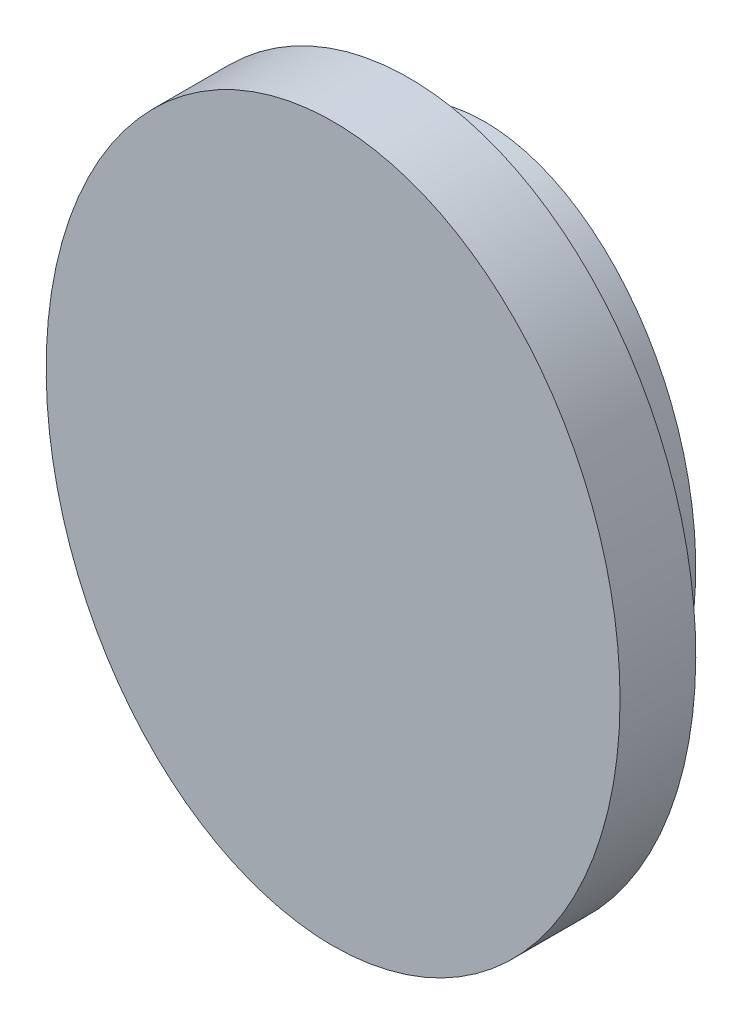
from build123d import *

# Parameters (mm, degrees)
BOSS_EXTRUDE1_DEPTH = 2.54
SKETCH3_RX          = 11.975002362
SKETCH3_RY          = 9.62530498
BOSS_EXTRUDE2_DEPTH = 2.54


with BuildPart() as part:
    # Sketch2 → Boss-Extrude1 (new body)
    with BuildSketch(Plane.XY):
        with BuildLine():
            add(Edge.make_bspline(
                [(1.27, 19.495012235), (0.720238368, 19.495012235), (0.185844427, 19.408896346), (-0.594767976, 19.162165307), (-0.850648642, 19.060010591), (-1.3406975, 18.824771934), (-1.57692884, 18.691089586), (-2.033244262, 18.394227435), (-2.254387801, 18.229997746), (-2.672354965, 17.881330388), (-2.870146059, 17.696467096), (-3.245718092, 17.307915457), (-3.423486564, 17.104215382), (-3.760412379, 16.679306346), (-3.920187654, 16.457107827), (-4.368044809, 15.772573183), (-4.623081735, 15.296400873), (-5.058948628, 14.310278998), (-5.239624245, 13.800259175), (-5.675397109, 12.221835404), (-5.815116994, 11.150473237), (-5.815398697, 9.517977005), (-5.779430411, 8.974598965), (-5.637433758, 7.906555412), (-5.53145557, 7.379220198), (-5.31698931, 6.598826265), (-5.236201641, 6.340472484), (-5.054795439, 5.827555685), (-4.954051366, 5.572982856), (-4.625557682, 4.828116166), (-4.370458524, 4.352200427), (-3.92715317, 3.673040761), (-3.769208225, 3.45247824), (-3.430720327, 3.024286098), (-3.250868957, 2.817759951), (-2.685744569, 2.232136484), (-2.272533636, 1.882567957), (-1.585243774, 1.433804725), (-1.346943211, 1.298634411), (-0.858258735, 1.06328463), (-0.606817547, 0.962380873), (-0.088456982, 0.797140288), (0.180616402, 0.732700885), (0.717663263, 0.647362415), (0.987116161, 0.625672865), (1.527886168, 0.62437222), (1.800139422, 0.644907177), (2.342616237, 0.72903885), (2.607409484, 0.791619312), (3.384065636, 1.035774015), (3.883121503, 1.277517664), (4.567246185, 1.721549842), (4.785790025, 1.883355998), (5.205380281, 2.232383298), (5.406610057, 2.42006263), (5.97350339, 3.006046128), (6.307709487, 3.430736806), (6.902207449, 4.337655014), (7.162728093, 4.822704649), (7.600031087, 5.812304067), (7.779637147, 6.320644481), (7.995612918, 7.101685429), (8.058634681, 7.365143206), (8.166913866, 7.898219317), (8.212140582, 8.168158838), (8.319734454, 8.975791274), (8.355084844, 9.515008844), (8.355523081, 10.594981282), (8.320552073, 11.136240082), (8.176885819, 12.218326747), (8.069718657, 12.748122566), (7.784197181, 13.785053947), (7.605910028, 14.292210886), (7.170666614, 15.281482851), (6.910823558, 15.767394967), (6.317632047, 16.675915486), (5.983849202, 17.101795462), (5.416898167, 17.690034607), (5.215754315, 17.878277673), (4.797746598, 18.22740935), (4.580118739, 18.389275101), (4.126199429, 18.685521759), (3.889921414, 18.819922454), (3.396302532, 19.057705745), (3.141299771, 19.159668895), (2.623738926, 19.324106952), (2.359807618, 19.3872776), (1.820922261, 19.472855931), (1.544880816, 19.495012235), (1.27, 19.495012235)],
                knots=[0, 0, 0, 0, 0.03125, 0.03125, 0.046875, 0.046875, 0.0625, 0.0625, 0.078125, 0.078125, 0.09375, 0.09375, 0.109375, 0.109375, 0.125, 0.125, 0.15625, 0.15625, 0.1875, 0.1875, 0.25, 0.25, 0.28125, 0.28125, 0.3125, 0.3125, 0.328125, 0.328125, 0.34375, 0.34375, 0.375, 0.375, 0.390625, 0.390625, 0.40625, 0.40625, 0.4375, 0.4375, 0.453125, 0.453125, 0.46875, 0.46875, 0.484375, 0.484375, 0.5, 0.5, 0.515625, 0.515625, 0.53125, 0.53125, 0.5625, 0.5625, 0.578125, 0.578125, 0.59375, 0.59375, 0.625, 0.625, 0.65625, 0.65625, 0.6875, 0.6875, 0.703125, 0.703125, 0.71875, 0.71875, 0.75, 0.75, 0.78125, 0.78125, 0.8125, 0.8125, 0.84375, 0.84375, 0.875, 0.875, 0.90625, 0.90625, 0.921875, 0.921875, 0.9375, 0.9375, 0.953125, 0.953125, 0.96875, 0.96875, 0.984375, 0.984375, 1, 1, 1, 1], degree=3))
        make_face()
    extrude(amount=-BOSS_EXTRUDE1_DEPTH)

    # Sketch3 → Boss-Extrude2 (add)
    with BuildSketch(Plane.XY):
        with Locations(Location((1.27, 10.060009873), (0, 0, -90))):
            Ellipse(SKETCH3_RX, SKETCH3_RY)
    extrude(amount=BOSS_EXTRUDE2_DEPTH)


solid = part.part
